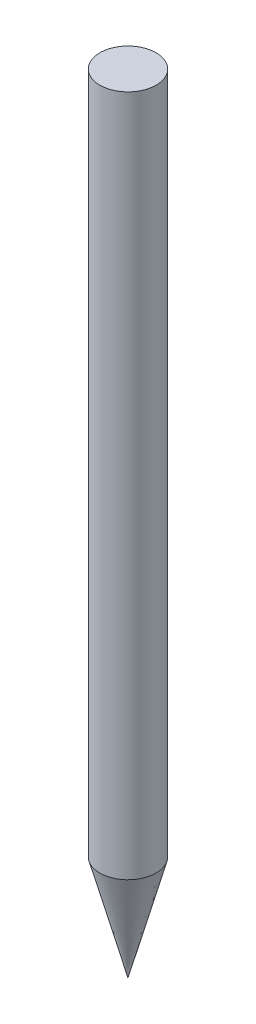
from build123d import *

# Parameters (mm, degrees)
SKETCH1_R           = 5
BOSS_EXTRUDE1_DEPTH = 140
CHAMFER1_SIZE       = 5
CHAMFER1_SIZE2      = 18.660254038


with BuildPart() as part:
    # Sketch1 → Boss-Extrude1 (new body)
    with BuildSketch(Plane(origin=(0, 0, 0), x_dir=(1, 0, 0), z_dir=(0, 1, 0))):
        with Locations(Location((0, 0, 0), (0, 0, 270))):
            Circle(SKETCH1_R)
    extrude(amount=BOSS_EXTRUDE1_DEPTH)

    # Chamfer1
    chamfer1_edges = [part.edges().sort_by_distance(p)[0] for p in [
        (0, 0, -5),
    ]]
    chamfer1_side = [part.faces().sort_by_distance(p)[0] for p in [
        (0, 0, 0),
    ]]
    chamfer(chamfer1_edges, length=CHAMFER1_SIZE, length2=CHAMFER1_SIZE2, reference=chamfer1_side[0])


solid = part.part
